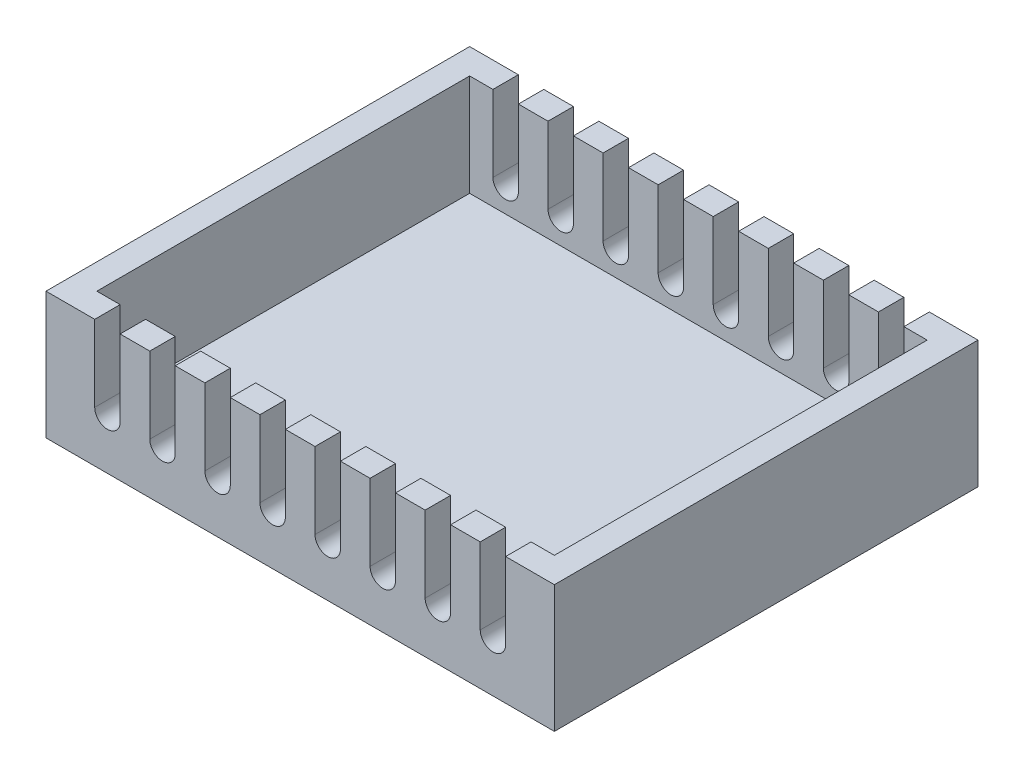
from build123d import *

# Parameters (mm, degrees)
BOSS_EXTRUDE1_DEPTH = 63.5
CUT_EXTRUDE2_REACH  = 82.274
CUT_EXTRUDE2_START  = -3.81
SKETCH2_W           = 68.58
SKETCH2_H           = 55.88


with BuildPart() as part:
    # Sketch1 → Boss-Extrude1 (new body)
    with BuildSketch(Plane.XY):
        with BuildLine():
            Line((-38.1, 9.525), (-38.1, -9.525))
            Line((-38.1, -9.525), (38.1, -9.525))
            Line((38.1, -9.525), (38.1, 9.525))
            Line((38.1, 9.525), (30.7975, 9.525))
            Line((30.7975, 9.525), (30.7975, -1.905))
            ThreePointArc((30.7975, -1.905), (28.8925, -3.81), (26.9875, -1.905))
            Line((26.9875, -1.905), (26.9875, 9.525))
            Line((26.9875, 9.525), (22.5425, 9.525))
            Line((22.5425, 9.525), (22.5425, -1.905))
            ThreePointArc((22.5425, -1.905), (20.6375, -3.81), (18.7325, -1.905))
            Line((18.7325, -1.905), (18.7325, 9.525))
            Line((18.7325, 9.525), (14.2875, 9.525))
            Line((14.2875, 9.525), (14.2875, -1.905))
            ThreePointArc((14.2875, -1.905), (12.3825, -3.81), (10.4775, -1.905))
            Line((10.4775, -1.905), (10.4775, 9.525))
            Line((10.4775, 9.525), (6.0325, 9.525))
            Line((6.0325, 9.525), (6.0325, -1.905))
            ThreePointArc((6.0325, -1.905), (4.1275, -3.81), (2.2225, -1.905))
            Line((2.2225, -1.905), (2.2225, 9.525))
            Line((2.2225, 9.525), (-2.2225, 9.525))
            Line((-2.2225, 9.525), (-2.2225, -1.905))
            ThreePointArc((-2.2225, -1.905), (-4.1275, -3.81), (-6.0325, -1.905))
            Line((-6.0325, -1.905), (-6.0325, 9.525))
            Line((-6.0325, 9.525), (-10.4775, 9.525))
            Line((-10.4775, 9.525), (-10.4775, -1.905))
            ThreePointArc((-10.4775, -1.905), (-12.3825, -3.81), (-14.2875, -1.905))
            Line((-14.2875, -1.905), (-14.2875, 9.525))
            Line((-14.2875, 9.525), (-18.7325, 9.525))
            Line((-18.7325, 9.525), (-18.7325, -1.905))
            ThreePointArc((-18.7325, -1.905), (-20.6375, -3.81), (-22.5425, -1.905))
            Line((-22.5425, -1.905), (-22.5425, 9.525))
            Line((-22.5425, 9.525), (-26.9875, 9.525))
            Line((-26.9875, 9.525), (-26.9875, -1.905))
            ThreePointArc((-26.9875, -1.905), (-28.8925, -3.81), (-30.7975, -1.905))
            Line((-30.7975, -1.905), (-30.7975, 9.525))
            Line((-30.7975, 9.525), (-38.1, 9.525))
        make_face()
    extrude(amount=BOSS_EXTRUDE1_DEPTH)

    # Sketch2 → Cut-Extrude2 (cut, up to next)
    with BuildSketch(Plane.XZ.offset(9.525).offset(CUT_EXTRUDE2_START), mode=Mode.PRIVATE) as cut_extrude2_sk1:
        with Locations((0, 31.75)):
            Rectangle(SKETCH2_W, SKETCH2_H)
    cut_extrude2_tool1 = extrude(cut_extrude2_sk1.sketch, amount=-CUT_EXTRUDE2_REACH, mode=Mode.PRIVATE) & part.part
    add(cut_extrude2_tool1.solids().sort_by_distance((0, -5.715, 31.75))[0], mode=Mode.SUBTRACT)


solid = part.part
